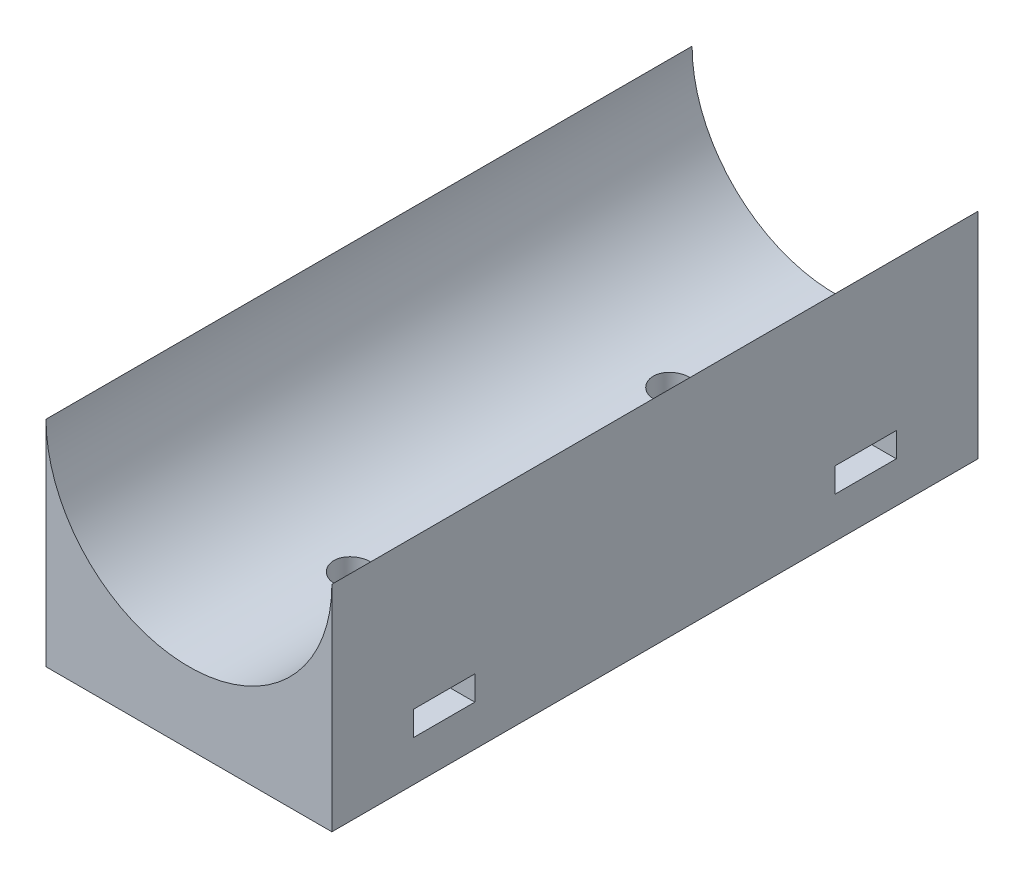
from build123d import *

# Parameters (mm, degrees)
BOSS_EXTRU_1_DEPTH      = 79.1
D_GAGEMENT_M41_D        = 4.5
D_GAGEMENT_M41_DEPTH    = 10
D_GAGEMENT_M41_TIP      = 1.351936393
ESQUISSE7_W             = 7.5
ESQUISSE7_H             = 3
BOSS_EXTRU_3_DEPTH      = 35
ESQUISSE7_2_W           = 7.5
ESQUISSE7_2_H           = 3
ENL_V_MAT_EXTRU_5_DEPTH = 35


with BuildPart() as part:
    # Esquisse1 → Boss.-Extru.1 (new body)
    with BuildSketch(Plane.XY.offset(1608.553140947)):
        with BuildLine():
            Line((0, 0), (35, 0))
            Line((35, 0), (35, 26.25))
            ThreePointArc((35, 26.25), (17.5, 8.75), (0, 26.25))
            Line((0, 26.25), (0, 0))
        make_face()
    extrude(amount=BOSS_EXTRU_1_DEPTH)

    # Dégagement M41
    with Locations(Plane(origin=(17.499999998, 8.75, 1628.553140947), x_dir=(1.0, -1.24e-10, 0), z_dir=(1.24e-10, 1.0, 0))):
        with Locations((0, 0), (2e-09, -39.1)):
            Hole(D_GAGEMENT_M41_D / 2, depth=D_GAGEMENT_M41_DEPTH)
            with Locations((0, 0, -(D_GAGEMENT_M41_DEPTH + D_GAGEMENT_M41_TIP / 2))):  # 118° drill point
                Cone(0, D_GAGEMENT_M41_D / 2, D_GAGEMENT_M41_TIP, mode=Mode.SUBTRACT)

    # Esquisse7 → Boss.-Extru.3 (add)
    with BuildSketch(Plane(origin=(35, 0, 0), x_dir=(0, 0, -1), z_dir=(1, 0, 0))):
        with Locations((-1673.903140947, 6.5)):
            Rectangle(ESQUISSE7_W, ESQUISSE7_H)
        with Locations((-1622.303140947, 6.5)):
            Rectangle(ESQUISSE7_W, ESQUISSE7_H)
    extrude(amount=-BOSS_EXTRU_3_DEPTH)

    # Esquisse7<2> → Enlèv. mat.-Extru.5 (cut)
    with BuildSketch(Plane(origin=(35, 0, 0), x_dir=(0, 0, -1), z_dir=(1, 0, 0))):
        with Locations((-1673.903140947, 6.5)):
            Rectangle(ESQUISSE7_2_W, ESQUISSE7_2_H)
        with Locations((-1622.303140947, 6.5)):
            Rectangle(ESQUISSE7_2_W, ESQUISSE7_2_H)
    extrude(amount=-ENL_V_MAT_EXTRU_5_DEPTH, mode=Mode.SUBTRACT)


solid = part.part
